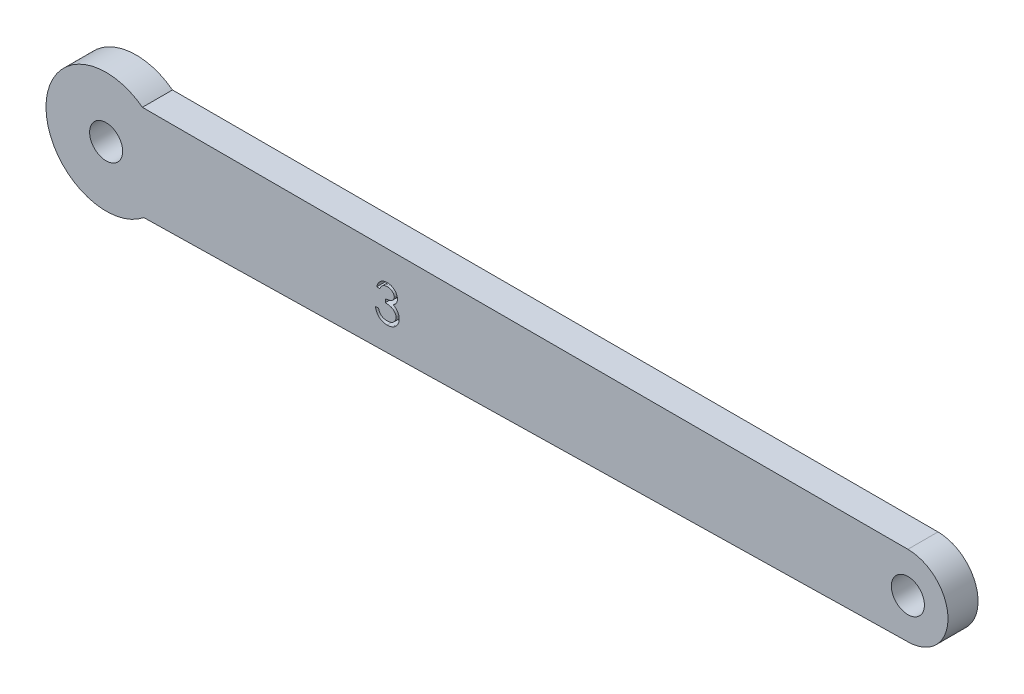
from build123d import *

# Parameters (mm, degrees)
EXTRUDE_1_DEPTH         = 3
SKETCH_2_R              = 1.35
CUT_EXTRUDE_1_DEPTH     = 2.444444444
SKETCH_3_R              = 1.35
CUT_EXTRUDE_2_DEPTH     = 0.555555556
HOLE_WIZARD_2_7_2_7_1_D = 2.7
SKETCH_6_R              = 1.65
CUT_EXTRUDE_3_DEPTH     = 64.035907885
CUT_EXTRUDE_4_DEPTH     = 1


with BuildPart() as part:
    # 草图1 → 凸台-拉伸1 (new body)
    with BuildSketch(Plane.XY.offset(3)):
        with BuildLine():
            Line((23.778016459, 8.467622986), (-52.596358319, 8.467622986))
            ThreePointArc((-52.596358319, 8.467622986), (-62.214907854, 3.590303351), (-52.451603626, -0.990377005))
            Line((-52.451603626, -0.990377005), (23.856567017, 0.468594516))
            ThreePointArc((23.856567017, 0.468594516), (27.777721585, 4.50700022), (23.778016459, 8.467622986))
        make_face()
    extrude(amount=-EXTRUDE_1_DEPTH)

    # 草图2 → 切除-拉伸1 (cut)
    with BuildSketch(Plane.XY.offset(3)):
        with Locations(Location((23.77801746, 4.467622995, 0), (0, 0, 180))):
            Circle(SKETCH_2_R)
    extrude(amount=-CUT_EXTRUDE_1_DEPTH, mode=Mode.SUBTRACT)

    # 草图3 → 切除-拉伸2 (cut)
    with BuildSketch(Plane(origin=(0, 0, 0), x_dir=(-1, 0, 0), z_dir=(0, 0, -1))):
        with Locations(Location((-23.778017455, 4.467823177, 0), (0, 0, 359.991504025))):
            Circle(SKETCH_3_R)
    extrude(amount=-CUT_EXTRUDE_2_DEPTH, mode=Mode.SUBTRACT)

    # Ø2.7 (2.7) 直径孔1 (through all)
    with Locations(Plane.XY.offset(3)):
        with Locations((-56.215609969, 3.682122995)):
            Hole(HOLE_WIZARD_2_7_2_7_1_D / 2)

    # 草图6 → 切除-拉伸3 (cut, through all)
    with BuildSketch(Plane.XY.offset(3)):
        with Locations((-56.215609969, 3.682122995)):
            Circle(SKETCH_6_R)
        with Locations((23.778017455, 4.467823177)):
            Circle(SKETCH_6_R)
    extrude(amount=-CUT_EXTRUDE_3_DEPTH, mode=Mode.SUBTRACT)

    # 草图7 → 切除-拉伸4 (cut)
    with BuildSketch(Plane.XY.offset(3)):
        with BuildLine():
            Line((-28.902991884, 4.643891928), (-29.217094448, 4.643891928))
            add(Edge.make_bspline(
                [(-29.217094448, 4.643891928), (-29.208584898, 4.679124412), (-29.191949422, 4.748001036), (-29.157251849, 4.846408297), (-29.119452594, 4.939531818), (-29.074063489, 5.025627892), (-29.024554735, 5.106426795), (-28.967832013, 5.180095919), (-28.906512291, 5.248508885), (-28.838687341, 5.309222122), (-28.76755868, 5.364199852), (-28.69212406, 5.411074909), (-28.613901166, 5.451399062), (-28.532348033, 5.484619294), (-28.447221862, 5.509644817), (-28.359292238, 5.527801623), (-28.268328738, 5.539592737), (-28.206581148, 5.5407435), (-28.175227461, 5.541327825)],
                knots=[0, 0, 0, 0, 1.162005537, 2.271625781, 3.343758855, 4.383309926, 5.390229558, 6.379919256, 7.361854164, 8.333198761, 9.295911338, 10.242430842, 11.177959212, 12.116337295, 13.062827104, 14.020064771, 14.994644689, 16, 16, 16, 16], degree=3))
            add(Edge.make_bspline(
                [(-28.175227461, 5.541327825), (-28.129544719, 5.539948595), (-28.039175708, 5.53722022), (-27.906412661, 5.512305783), (-27.778385842, 5.472880651), (-27.656496594, 5.418406924), (-27.543278162, 5.35121961), (-27.442541975, 5.271254874), (-27.355653464, 5.180055572), (-27.282759087, 5.079323008), (-27.225684088, 4.971667498), (-27.183597714, 4.860867341), (-27.157976033, 4.74718537), (-27.154655476, 4.670428091), (-27.152991884, 4.631972857)],
                knots=[0, 0, 0, 0, 1.083050992, 2.142477498, 3.193116406, 4.255571735, 5.30263384, 6.308962982, 7.297363603, 8.282367274, 9.249857812, 10.179914175, 11.08814088, 12, 12, 12, 12], degree=3))
            add(Edge.make_bspline(
                [(-27.152991884, 4.631972857), (-27.154155475, 4.594966063), (-27.156432443, 4.522549508), (-27.175766148, 4.416828011), (-27.208302411, 4.317186411), (-27.253372174, 4.223205249), (-27.311713724, 4.135480409), (-27.382386421, 4.053814518), (-27.465889082, 3.97784536), (-27.52916802, 3.934325887), (-27.561745891, 3.911920774)],
                knots=[0, 0, 0, 0, 1.024540389, 2.004866551, 2.965041327, 3.920577974, 4.882998113, 5.874504559, 6.905732034, 8, 8, 8, 8], degree=3))
            add(Edge.make_bspline(
                [(-27.561745891, 3.911920774), (-27.524514136, 3.893942602), (-27.450747262, 3.858322645), (-27.350196732, 3.788466887), (-27.258918857, 3.70781054), (-27.208015138, 3.644867887), (-27.182439, 3.613242889)],
                knots=[0, 0, 0, 0, 1.015518401, 2.012035669, 3.001164323, 4, 4, 4, 4], degree=3))
            add(Edge.make_bspline(
                [(-27.182439, 3.613242889), (-27.165597657, 3.590185138), (-27.132190761, 3.544447221), (-27.090955228, 3.470910795), (-27.053546113, 3.396559306), (-27.024395894, 3.3193999), (-27.001822027, 3.240326886), (-26.985685995, 3.15920449), (-26.975661854, 3.075966468), (-26.974226302, 3.019653988), (-26.973504705, 2.991347857)],
                knots=[0, 0, 0, 0, 1.025084078, 2.033381695, 3.024893161, 4.013698104, 4.991890475, 5.976764909, 6.982997093, 8, 8, 8, 8], degree=3))
            add(Edge.make_bspline(
                [(-26.973504705, 2.991347857), (-26.975299218, 2.942338136), (-26.9788798, 2.844549334), (-27.010883875, 2.700074613), (-27.060497115, 2.55884911), (-27.130954051, 2.423774271), (-27.21682156, 2.29739389), (-27.318978884, 2.184317581), (-27.436265293, 2.087118977), (-27.567070942, 2.005908749), (-27.70878807, 1.940990827), (-27.860363662, 1.895933384), (-28.019613716, 1.866587384), (-28.128821014, 1.863440515), (-28.184342045, 1.861840646)],
                knots=[0, 0, 0, 0, 0.955779014, 1.907060117, 2.875433937, 3.871313158, 4.872415639, 5.851225146, 6.836215519, 7.83643374, 8.849228613, 9.86973379, 10.916971861, 12, 12, 12, 12], degree=3))
            add(Edge.make_bspline(
                [(-28.184342045, 1.861840646), (-28.221761345, 1.862708859), (-28.29539005, 1.864417213), (-28.403633548, 1.876095814), (-28.506955248, 1.89742582), (-28.605494846, 1.926129125), (-28.699339882, 1.962520867), (-28.788203987, 2.007839565), (-28.872633881, 2.061151067), (-28.951832832, 2.123084655), (-29.0257914, 2.192365995), (-29.092544124, 2.270225005), (-29.153203917, 2.355222409), (-29.206146555, 2.448345465), (-29.253783508, 2.548390722), (-29.292964465, 2.656639221), (-29.327450033, 2.772123243), (-29.343483498, 2.852600983), (-29.351709833, 2.893891928)],
                knots=[0, 0, 0, 0, 1.048658725, 2.063410685, 3.046034179, 4.001477787, 4.936774919, 5.862367409, 6.792675028, 7.730719943, 8.675894397, 9.627829632, 10.600096036, 11.597688215, 12.626045268, 13.701542398, 14.82072376, 16, 16, 16, 16], degree=3))
            Line((-29.351709833, 2.893891928), (-29.037607269, 2.893891928))
            add(Edge.make_bspline(
                [(-29.037607269, 2.893891928), (-29.029423978, 2.866942915), (-29.013506765, 2.814524743), (-28.986412467, 2.739084437), (-28.955544195, 2.669926384), (-28.922429636, 2.606543262), (-28.88765119, 2.54831086), (-28.848736265, 2.496768991), (-28.80856712, 2.449653788), (-28.778287766, 2.423109176), (-28.763468647, 2.410117889)],
                knots=[0, 0, 0, 0, 1.198163088, 2.33053128, 3.407730985, 4.417276592, 5.372219308, 6.28897303, 7.162600585, 8, 8, 8, 8], degree=3))
            add(Edge.make_bspline(
                [(-28.763468647, 2.410117889), (-28.743872071, 2.395009556), (-28.704739408, 2.364839524), (-28.640971177, 2.326337895), (-28.573906291, 2.29297687), (-28.502091616, 2.267493174), (-28.427076846, 2.245915513), (-28.347649481, 2.231794994), (-28.264510264, 2.222106823), (-28.2077425, 2.221251891), (-28.17873307, 2.220815005)],
                knots=[0, 0, 0, 0, 0.946170439, 1.889420265, 2.845303464, 3.807233317, 4.801018734, 5.828864929, 6.890507805, 8, 8, 8, 8], degree=3))
            add(Edge.make_bspline(
                [(-28.17873307, 2.220815005), (-28.145979568, 2.22143091), (-28.081932921, 2.22263526), (-27.988478061, 2.233710966), (-27.899570614, 2.24984138), (-27.816197688, 2.274754363), (-27.737267181, 2.305535214), (-27.663885531, 2.34418362), (-27.595089425, 2.389528341), (-27.531760019, 2.4410675), (-27.474814512, 2.497488995), (-27.424674999, 2.556502066), (-27.382050337, 2.617857896), (-27.347666759, 2.681896016), (-27.320516209, 2.748351245), (-27.302033008, 2.817410075), (-27.289181493, 2.888507341), (-27.288134881, 2.93683631), (-27.287607269, 2.96119962)],
                knots=[0, 0, 0, 0, 1.217147791, 2.380027433, 3.494444702, 4.572153297, 5.609568379, 6.639424714, 7.649109417, 8.668170816, 9.669597737, 10.625200337, 11.543417969, 12.441394052, 13.322311151, 14.205496177, 15.095365482, 16, 16, 16, 16], degree=3))
            add(Edge.make_bspline(
                [(-27.287607269, 2.96119962), (-27.289137571, 2.993810959), (-27.292190559, 3.058871367), (-27.315499138, 3.154588942), (-27.353838003, 3.246812354), (-27.407510514, 3.333968144), (-27.472846243, 3.414744046), (-27.549211149, 3.486815528), (-27.637239378, 3.546285619), (-27.718259247, 3.587374276), (-27.790024403, 3.615411351), (-27.851439788, 3.634086315), (-27.920196391, 3.649899971), (-27.99546274, 3.664612242), (-28.077805957, 3.677133591), (-28.167136394, 3.687575406), (-28.263472156, 3.695930447), (-28.330163322, 3.699661543), (-28.364530346, 3.701584236)],
                knots=[0, 0, 0, 0, 1.07054697, 2.135767047, 3.216561865, 4.33974944, 5.486079747, 6.621378074, 7.775625952, 8.963672916, 9.598146892, 10.304877434, 11.070270905, 11.915000392, 12.823868403, 13.805723172, 14.86925407, 16, 16, 16, 16], degree=3))
            Line((-28.364530346, 3.701584236), (-28.364530346, 4.060558595))
            add(Edge.make_bspline(
                [(-28.364530346, 4.060558595), (-28.32122918, 4.061293398), (-28.236412834, 4.062732698), (-28.112518529, 4.080140709), (-27.994045217, 4.104221337), (-27.883618475, 4.141106529), (-27.782969761, 4.183946826), (-27.695650159, 4.233799035), (-27.622883012, 4.289213785), (-27.565021941, 4.351046394), (-27.521492712, 4.417361441), (-27.489665914, 4.486478099), (-27.470865588, 4.55900216), (-27.468355921, 4.608496828), (-27.467094448, 4.633375101)],
                knots=[0, 0, 0, 0, 1.321986639, 2.589447074, 3.816329219, 5.01088745, 6.139805852, 7.153945165, 8.075214402, 8.924034688, 9.728124013, 10.488707548, 11.240355623, 12, 12, 12, 12], degree=3))
            add(Edge.make_bspline(
                [(-27.467094448, 4.633375101), (-27.467508859, 4.651652846), (-27.46833331, 4.688015553), (-27.478730588, 4.741140622), (-27.494354629, 4.792641568), (-27.515834358, 4.842299378), (-27.544584557, 4.889769652), (-27.578990544, 4.935457101), (-27.619958644, 4.97910088), (-27.666904091, 5.019781199), (-27.717315896, 5.058550437), (-27.772565671, 5.091464074), (-27.830987546, 5.119609136), (-27.892646201, 5.142818638), (-27.957741731, 5.160277926), (-28.025968289, 5.172813767), (-28.097455972, 5.180651422), (-28.146227704, 5.181779838), (-28.171020731, 5.182353466)],
                knots=[0, 0, 0, 0, 0.884392785, 1.759457502, 2.611959086, 3.489218968, 4.37281399, 5.2945488, 6.255912374, 7.266815255, 8.301784654, 9.332968512, 10.37626691, 11.440494194, 12.520033166, 13.637162961, 14.798855837, 16, 16, 16, 16], degree=3))
            add(Edge.make_bspline(
                [(-28.171020731, 5.182353466), (-28.210872399, 5.180962104), (-28.288711975, 5.178244451), (-28.400926892, 5.154441437), (-28.505246226, 5.116463354), (-28.584984892, 5.071130334), (-28.643867467, 5.026379901), (-28.685944405, 4.987297514), (-28.727264915, 4.94386469), (-28.765110592, 4.893406315), (-28.803384569, 4.839339525), (-28.83822913, 4.778915843), (-28.872088822, 4.713711449), (-28.892491372, 4.667615815), (-28.902991884, 4.643891928)],
                knots=[0, 0, 0, 0, 1.472543308, 2.876219568, 4.221790263, 5.565193594, 6.249813518, 6.953379497, 7.687249741, 8.463570142, 9.283606569, 10.136032583, 11.040678096, 12, 12, 12, 12], degree=3))
        make_face()
    extrude(amount=-CUT_EXTRUDE_4_DEPTH, mode=Mode.SUBTRACT)


solid = part.part
